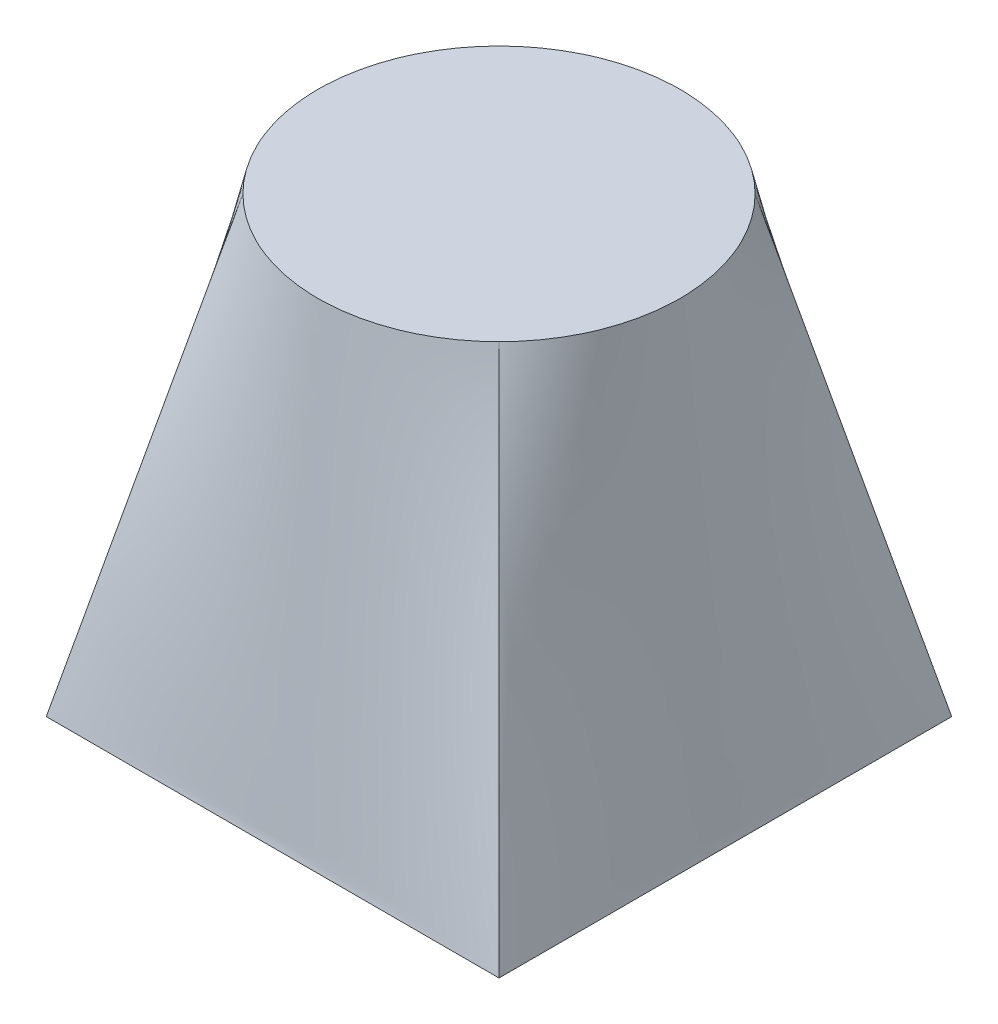
from build123d import *


with BuildPart() as part:
    # Sketch1 → Loft1 section 0
    with BuildSketch(Plane(origin=(0, 0, 0), x_dir=(1, 0, 0), z_dir=(0, 1, 0))):
        with BuildLine():
            Line((-5, -5), (5, -5))
            Line((5, -5), (5, 5))
            Line((5, 5), (-5, 5))
            Line((-5, 5), (-5, -5))
        make_face()
    # Sketch2 for Loft1 → Loft1 section 1
    with BuildSketch(Plane(origin=(0, 10, 0), x_dir=(1, 0, 0), z_dir=(0, 1, 0))):
        with BuildLine():
            # circular arc as an exact rational Bezier (weights 1, cos(half-angle), 1)
            Bezier((-2.828427125, -2.828427125), (0, -5.656854249), (2.828427125, -2.828427125), weights=[1, 0.707106781, 1])
            Bezier((2.828427125, -2.828427125), (5.656854249, 0), (2.828427125, 2.828427125), weights=[1, 0.707106781, 1])
            Bezier((2.828427125, 2.828427125), (0, 5.656854249), (-2.828427125, 2.828427125), weights=[1, 0.707106781, 1])
            Bezier((-2.828427125, 2.828427125), (-5.656854249, 0), (-2.828427125, -2.828427125), weights=[1, 0.707106781, 1])
        make_face()
    loft()


solid = part.part
